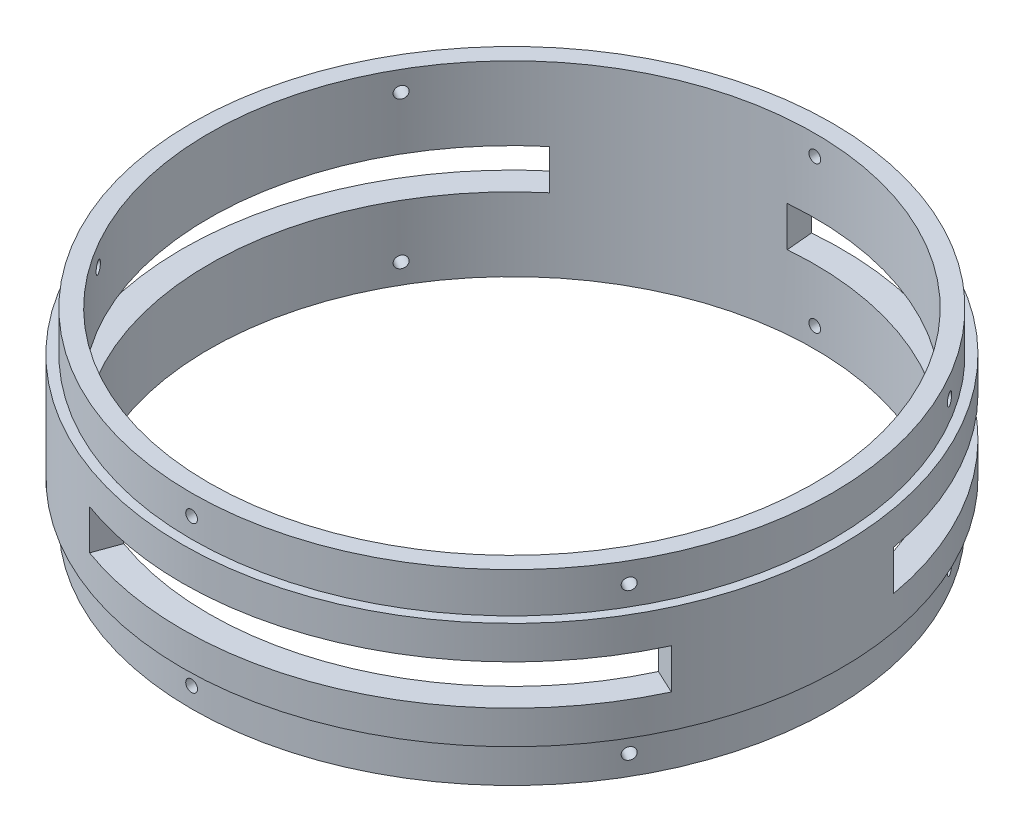
from build123d import *

# Parameters (mm, degrees)
SKETCH1_R               = 78.359
SKETCH1_R_2             = 72.009
BOSS_EXTRUDE1_DEPTH     = 22.225
SKETCH2_R               = 78.359
SKETCH2_R_2             = 76.1746
CUT_EXTRUDE1_DEPTH      = 9.525
CUT_EXTRUDE2_REACH      = 176.685
CUT_EXTRUDE2_END_RADIUS = 72.009
SKETCH3_R               = 1.397
CIRPATTERN1_COUNT       = 6
CUT_EXTRUDE3_DEPTH      = 4.7625
CIRPATTERN2_COUNT       = 3


with BuildPart() as part:
    # Sketch1 → Boss-Extrude1 (new, symmetric)
    with BuildSketch(Plane(origin=(0, 0, 0), x_dir=(1, 0, 0), z_dir=(0, 1, 0))):
        with Locations(Location((0, 0, 0), (0, 0, 270))):
            Circle(SKETCH1_R)
        with Locations(Location((0, 0, 0), (0, 0, 270))):
            Circle(SKETCH1_R_2, mode=Mode.SUBTRACT)
    extrude(amount=BOSS_EXTRUDE1_DEPTH, both=True)

    # Sketch2 → Cut-Extrude1 (cut)
    with BuildSketch(Plane(origin=(0, 22.225, 0), x_dir=(1, 0, 0), z_dir=(0, 1, 0))):
        with Locations(Location((0, 0, 0), (0, 0, 270))):
            Circle(SKETCH2_R)
        with Locations(Location((0, 0, 0), (0, 0, 270))):
            Circle(SKETCH2_R_2, mode=Mode.SUBTRACT)
    cut_extrude1 = extrude(amount=-CUT_EXTRUDE1_DEPTH, mode=Mode.SUBTRACT)

    # Mirror1: Cut-Extrude1 across plane
    add(cut_extrude1.mirror(Plane.ZX), mode=Mode.SUBTRACT)

    # Cut-Extrude2: up to this cylinder (the profile starts outside it)
    cut_extrude2_end = Plane(origin=(0, 0, 0), z_dir=(0, -1, 0)) * Cylinder(CUT_EXTRUDE2_END_RADIUS, 533.313, mode=Mode.PRIVATE)
    # Sketch3 → Cut-Extrude2 (cut, up to the surface)
    with BuildSketch(Plane.XY.offset(76.1746), mode=Mode.PRIVATE) as cut_extrude2_sk1:
        with Locations((0, 17.4625)):
            Circle(SKETCH3_R)
    cut_extrude2_tool1 = extrude(cut_extrude2_sk1.sketch, amount=-CUT_EXTRUDE2_REACH, mode=Mode.PRIVATE) - cut_extrude2_end
    # Sketch3 → Cut-Extrude2 (cut, up to the surface)
    with BuildSketch(Plane.XY.offset(76.1746), mode=Mode.PRIVATE) as cut_extrude2_sk2:
        with Locations((0, -17.4625)):
            Circle(SKETCH3_R)
    cut_extrude2_tool2 = extrude(cut_extrude2_sk2.sketch, amount=-CUT_EXTRUDE2_REACH, mode=Mode.PRIVATE) - cut_extrude2_end
    cut_extrude2 = cut_extrude2_tool1.solids().sort_by_distance((0, 17.4625, 76.1746))[0] + cut_extrude2_tool2.solids().sort_by_distance((0, -17.4625, 76.1746))[0]
    add(cut_extrude2, mode=Mode.SUBTRACT)

    # CirPattern1: Cut-Extrude2 ×6 about axis
    cirpattern1_axis = Axis((0, 22.225, 0), (0, -1, 0))
    for i in range(1, CIRPATTERN1_COUNT):
        add(cut_extrude2.rotate(cirpattern1_axis, i * 360 / CIRPATTERN1_COUNT), mode=Mode.SUBTRACT)

    # Sketch5 → Cut-Extrude3 (cut, symmetric)
    with BuildSketch(Plane(origin=(0, 0, 0), x_dir=(1, 0, 0), z_dir=(0, 1, 0))):
        with BuildLine():
            Line((0, 0), (-6.829436846, 78.060820348))
            ThreePointArc((-6.829436846, 78.060820348), (47.701936816, 62.166374392), (77.168550718, 13.606897554))
            Line((77.168550718, 13.606897554), (0, 0))
        make_face()
    cut_extrude3 = extrude(amount=CUT_EXTRUDE3_DEPTH, both=True, mode=Mode.SUBTRACT)

    # CirPattern2: Cut-Extrude3 ×3 about axis
    cirpattern2_axis = Axis((0, 0, 0), (0, 1, 0))
    for i in range(1, CIRPATTERN2_COUNT):
        add(cut_extrude3.rotate(cirpattern2_axis, i * 360 / CIRPATTERN2_COUNT), mode=Mode.SUBTRACT)


solid = part.part
